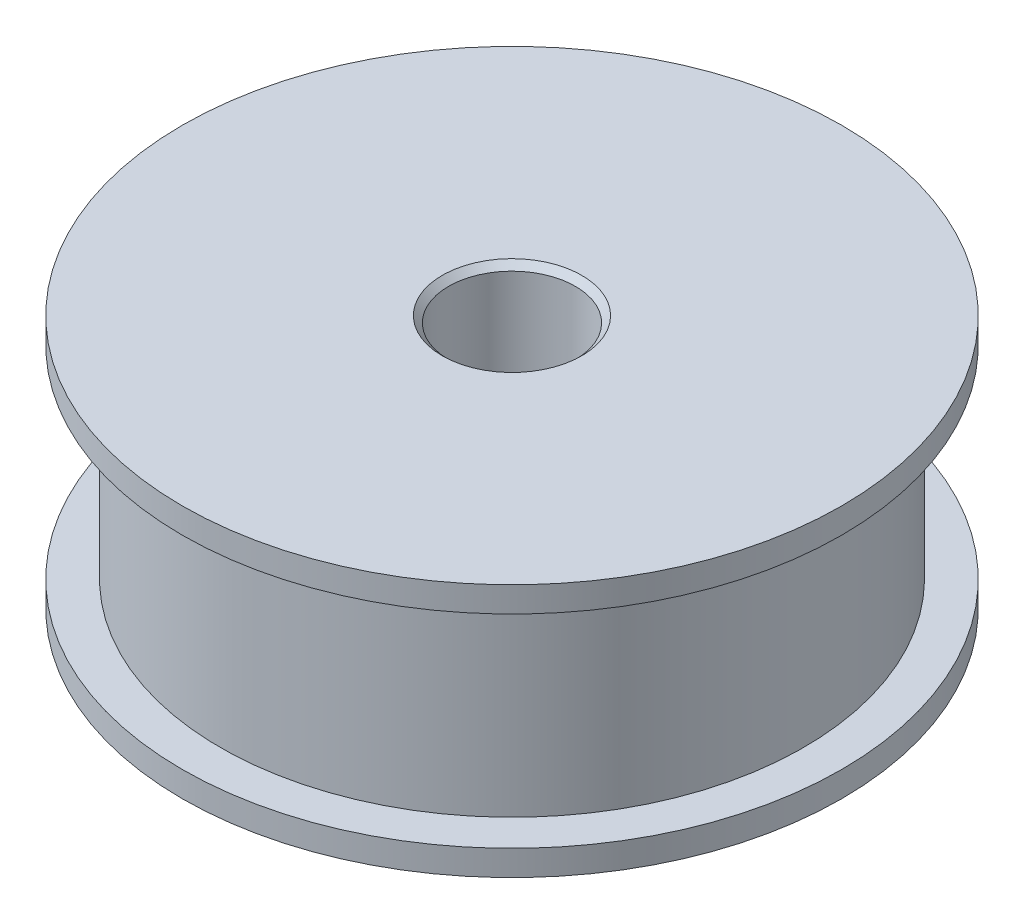
from build123d import *

# Parameters (mm, degrees)
SKETCH_1_R          = 26
EXTRUDE_1_DEPTH     = 20
CUT_EXTRUDE_START   = -2
SKETCH_2_R          = 26
SKETCH_2_R_2        = 23
CUT_EXTRUDE_1_DEPTH = 16
SKETCH_3_R          = 5
CUT_EXTRUDE_2_DEPTH = 42.856899073
CHAMFER_1_SIZE      = 0.5
SKETCH_4_R          = 1.25
CUT_EXTRUDE_3_DEPTH = 42.856899073
SKETCH_5_R          = 1.25
CUT_EXTRUDE_4_DEPTH = 42.856899073


with BuildPart() as part:
    # 草图1 → 凸台-拉伸1 (new body)
    with BuildSketch(Plane(origin=(0, 0, 0), x_dir=(1, 0, 0), z_dir=(0, 1, 0))):
        with Locations(Location((0, 0, 0), (0, 0, 270))):
            Circle(SKETCH_1_R)
    extrude(amount=EXTRUDE_1_DEPTH)

    # 草图2 → 切除-拉伸1 (cut)
    with BuildSketch(Plane.XZ.offset(CUT_EXTRUDE_START)):
        with Locations(Location((0, 0, 0), (0, 0, 270))):
            Circle(SKETCH_2_R)
        with Locations(Location((0, 0, 0), (0, 0, 270))):
            Circle(SKETCH_2_R_2, mode=Mode.SUBTRACT)
    extrude(amount=-CUT_EXTRUDE_1_DEPTH, mode=Mode.SUBTRACT)

    # 草图3 → 切除-拉伸2 (cut, through all)
    with BuildSketch(Plane.XZ):
        with Locations(Location((0, 0, 0), (0, 0, 270))):
            Circle(SKETCH_3_R)
    extrude(amount=-CUT_EXTRUDE_2_DEPTH, mode=Mode.SUBTRACT)

    # 倒角1
    chamfer_1_edges = [part.edges().sort_by_distance(p)[0] for p in [
        (0, 20, 5),
        (0, 0, 5),
    ]]
    chamfer(chamfer_1_edges, length=CHAMFER_1_SIZE)

    # 草图4 → 切除-拉伸3 (cut, through all)
    with BuildSketch(Plane.XY):
        with Locations(Location((0, 10, 0), (0, 0, 90))):
            Circle(SKETCH_4_R)
    extrude(amount=-CUT_EXTRUDE_3_DEPTH, mode=Mode.SUBTRACT)

    # 草图5 → 切除-拉伸4 (cut, through all)
    with BuildSketch(Plane(origin=(0, 0, 0), x_dir=(0, 0, -1), z_dir=(1, 0, 0))):
        with Locations((0, 10)):
            Circle(SKETCH_5_R)
    extrude(amount=-CUT_EXTRUDE_4_DEPTH, mode=Mode.SUBTRACT)


solid = part.part
